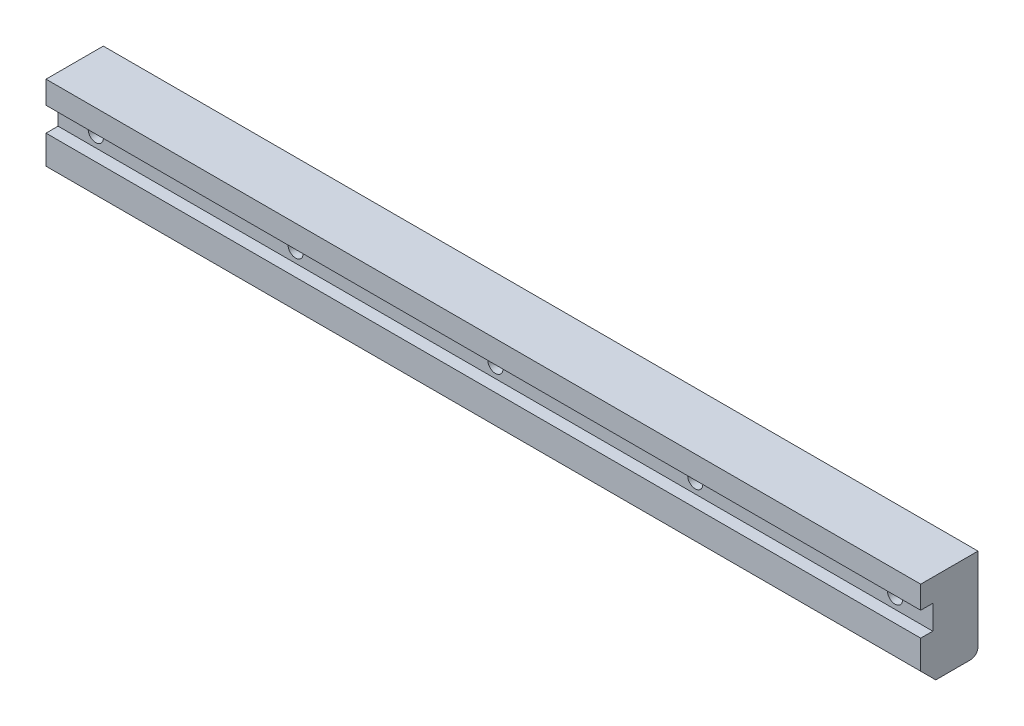
from build123d import *

# Parameters (mm, degrees)
SALIENTE_EXTRUIR1_DEPTH = 580
REDONDEO1_R             = 5
CORTAR_EXTRUIR1_REACH   = 585.866
CROQUIS2_R              = 5


with BuildPart() as part:
    # Croquis1 → Saliente-Extruir1 (new body)
    with BuildSketch(Plane(origin=(0, 0, 0), x_dir=(0, 0, -1), z_dir=(1, 0, 0))):
        Polygon((10, 0), (0, 10), (0, 29), (8, 29), (8, 45), (0, 45), (0, 60), (38, 60), (38, 0), align=None)
    extrude(amount=SALIENTE_EXTRUIR1_DEPTH)

    # Redondeo1
    redondeo1_edges = [part.edges().sort_by_distance(p)[0] for p in [
        (290, 0, -38),
    ]]
    fillet(redondeo1_edges, radius=REDONDEO1_R)

    # Croquis2 → Cortar-Extruir1 (cut, up to next)
    with BuildSketch(Plane.XY.offset(-8), mode=Mode.PRIVATE) as cortar_extruir1_sk1:
        with Locations((25, 37)):
            Circle(CROQUIS2_R)
    cortar_extruir1_tool1 = extrude(cortar_extruir1_sk1.sketch, amount=-CORTAR_EXTRUIR1_REACH, mode=Mode.PRIVATE) & part.part
    # Croquis2 → Cortar-Extruir1 (cut, up to next)
    with BuildSketch(Plane.XY.offset(-8), mode=Mode.PRIVATE) as cortar_extruir1_sk2:
        with Locations((157.5, 37)):
            Circle(CROQUIS2_R)
    cortar_extruir1_tool2 = extrude(cortar_extruir1_sk2.sketch, amount=-CORTAR_EXTRUIR1_REACH, mode=Mode.PRIVATE) & part.part
    # Croquis2 → Cortar-Extruir1 (cut, up to next)
    with BuildSketch(Plane.XY.offset(-8), mode=Mode.PRIVATE) as cortar_extruir1_sk3:
        with Locations((555, 37)):
            Circle(CROQUIS2_R)
    cortar_extruir1_tool3 = extrude(cortar_extruir1_sk3.sketch, amount=-CORTAR_EXTRUIR1_REACH, mode=Mode.PRIVATE) & part.part
    # Croquis2 → Cortar-Extruir1 (cut, up to next)
    with BuildSketch(Plane.XY.offset(-8), mode=Mode.PRIVATE) as cortar_extruir1_sk4:
        with Locations((290, 37)):
            Circle(CROQUIS2_R)
    cortar_extruir1_tool4 = extrude(cortar_extruir1_sk4.sketch, amount=-CORTAR_EXTRUIR1_REACH, mode=Mode.PRIVATE) & part.part
    # Croquis2 → Cortar-Extruir1 (cut, up to next)
    with BuildSketch(Plane.XY.offset(-8), mode=Mode.PRIVATE) as cortar_extruir1_sk5:
        with Locations((422.5, 37)):
            Circle(CROQUIS2_R)
    cortar_extruir1_tool5 = extrude(cortar_extruir1_sk5.sketch, amount=-CORTAR_EXTRUIR1_REACH, mode=Mode.PRIVATE) & part.part
    add(cortar_extruir1_tool1.solids().sort_by_distance((25, 37, -8))[0], mode=Mode.SUBTRACT)
    add(cortar_extruir1_tool2.solids().sort_by_distance((157.5, 37, -8))[0], mode=Mode.SUBTRACT)
    add(cortar_extruir1_tool3.solids().sort_by_distance((555, 37, -8))[0], mode=Mode.SUBTRACT)
    add(cortar_extruir1_tool4.solids().sort_by_distance((290, 37, -8))[0], mode=Mode.SUBTRACT)
    add(cortar_extruir1_tool5.solids().sort_by_distance((422.5, 37, -8))[0], mode=Mode.SUBTRACT)


solid = part.part
